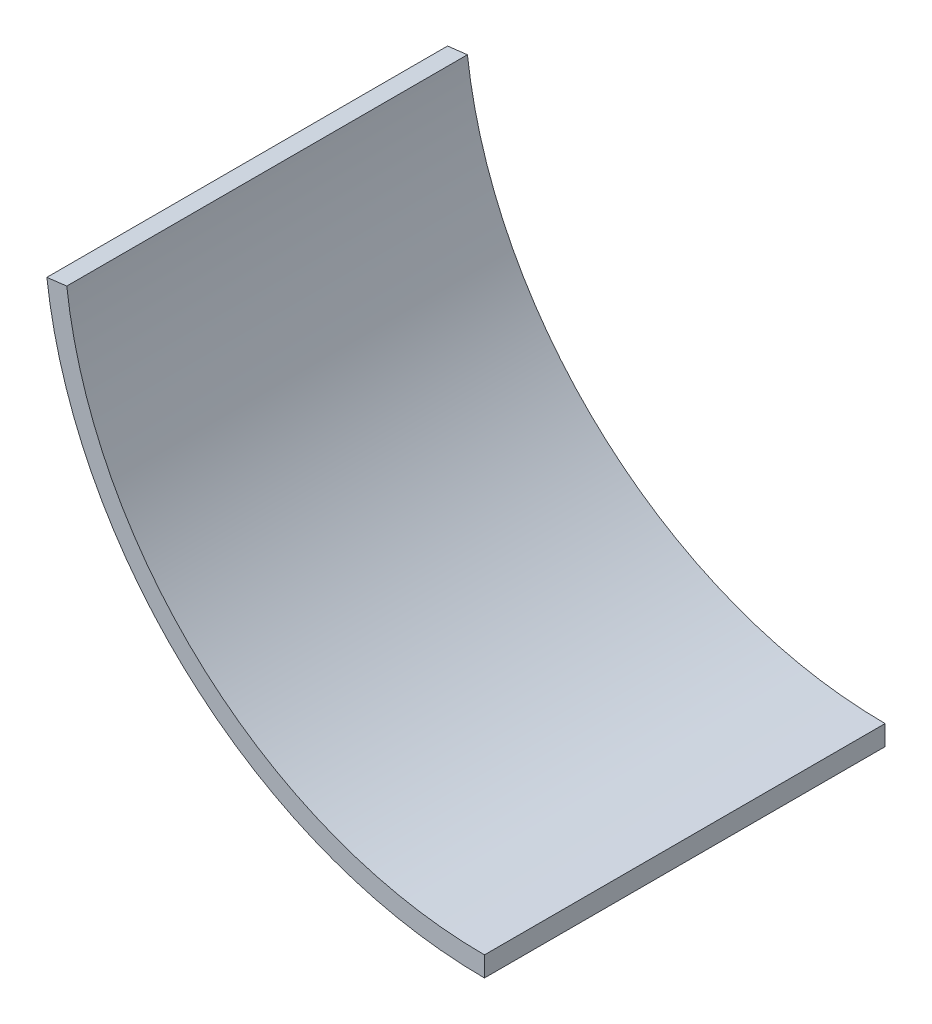
from build123d import *

# Parameters (mm, degrees)
EXTRUDE_1_DEPTH = 20


with BuildPart() as part:
    # 草圖1 → 填料-伸長1 (new body)
    with BuildSketch(Plane.XY):
        with BuildLine():
            Line((-145, -56), (-145, -57))
            ThreePointArc((-145, -57), (-159.595989048, -51.4607747), (-166.841935203, -37.632463975))
            Line((-166.841935203, -37.632463975), (-165.849119967, -37.512806521))
            ThreePointArc((-165.849119967, -37.512806521), (-158.932535, -50.712557668), (-145, -56))
        make_face()
    extrude(amount=EXTRUDE_1_DEPTH)


solid = part.part
